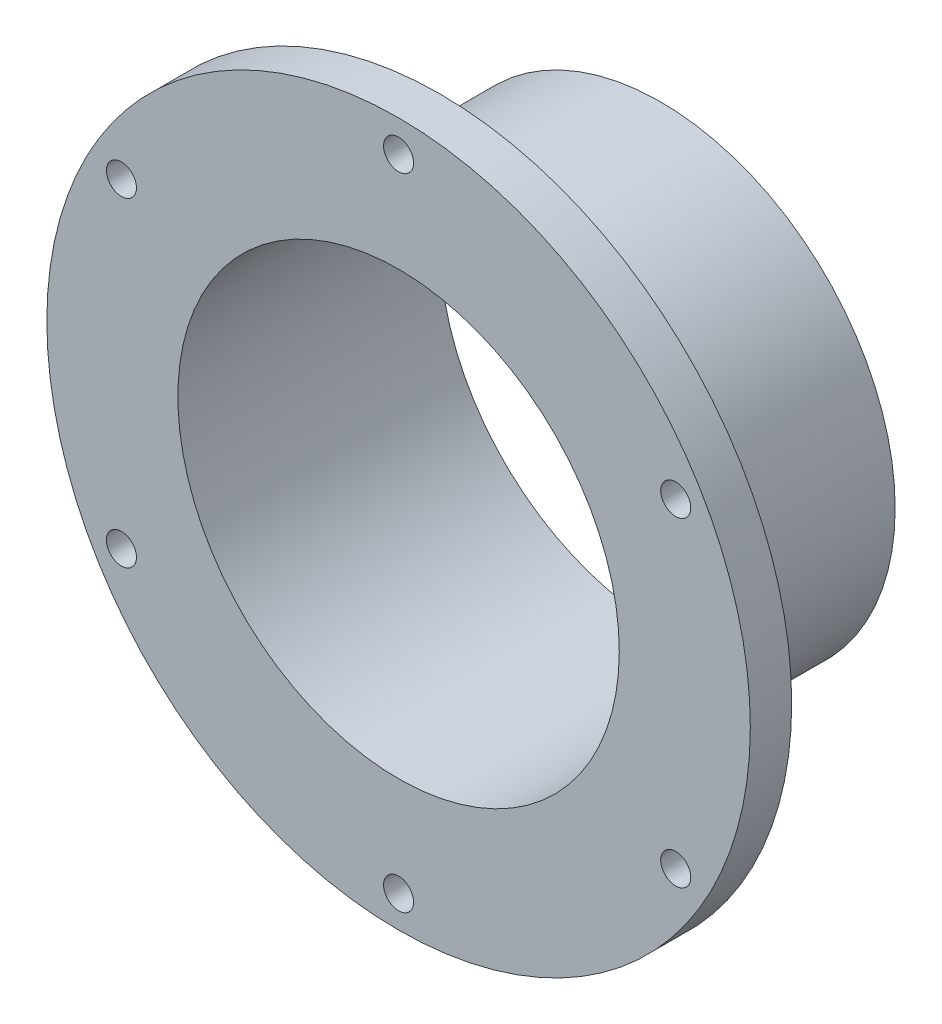
from build123d import *

# Parameters (mm, degrees)
SKETCH1_R           = 26.9875
SKETCH1_R_2         = 25.4
BOSS_EXTRUDE1_DEPTH = 25.4
SKETCH2_R           = 40.48125
SKETCH2_R_2         = 25.4
BOSS_EXTRUDE2_DEPTH = 4.7625
FILLET1_R           = 5.08
CIRPATTERN1_COUNT   = 6


with BuildPart() as part:
    # Sketch1 → Boss-Extrude1 (new body)
    with BuildSketch(Plane.XY):
        Circle(SKETCH1_R)
        Circle(SKETCH1_R_2, mode=Mode.SUBTRACT)
    extrude(amount=BOSS_EXTRUDE1_DEPTH)

    # Sketch2 → Boss-Extrude2 (add)
    with BuildSketch(Plane.XY.offset(25.4)):
        with Locations(Location((0, 0, 0), (0, 0, 180))):
            Circle(SKETCH2_R)
        Circle(SKETCH2_R_2, mode=Mode.SUBTRACT)
    extrude(amount=BOSS_EXTRUDE2_DEPTH)

    # Fillet1
    fillet1_edges = [part.edges().sort_by_distance(p)[0] for p in [
        (-26.9875, 0, 25.4),
    ]]
    fillet(fillet1_edges, radius=FILLET1_R)

    # Sketch7 → #8-32 Tapped Hole1 (revolve, cut)
    with BuildSketch(Plane(origin=(0, 36.83, 30.1625), x_dir=(0, -1, 0), z_dir=(1, 0, 0))):
        Polygon((0, 0), (0, 11.705806461), (1.7272, 10.668), (1.7272, 0), align=None)
    f_8_32_tapped_hole1 = revolve(axis=Axis((0, 36.83, 36.5125), (0, 0, -1)), mode=Mode.SUBTRACT)

    # CirPattern1: #8-32 Tapped Hole1 ×6 about axis
    cirpattern1_axis = Axis((0, 0, 0), (0, 0, 1))
    for i in range(1, CIRPATTERN1_COUNT):
        add(f_8_32_tapped_hole1.rotate(cirpattern1_axis, i * 360 / CIRPATTERN1_COUNT), mode=Mode.SUBTRACT)


solid = part.part
